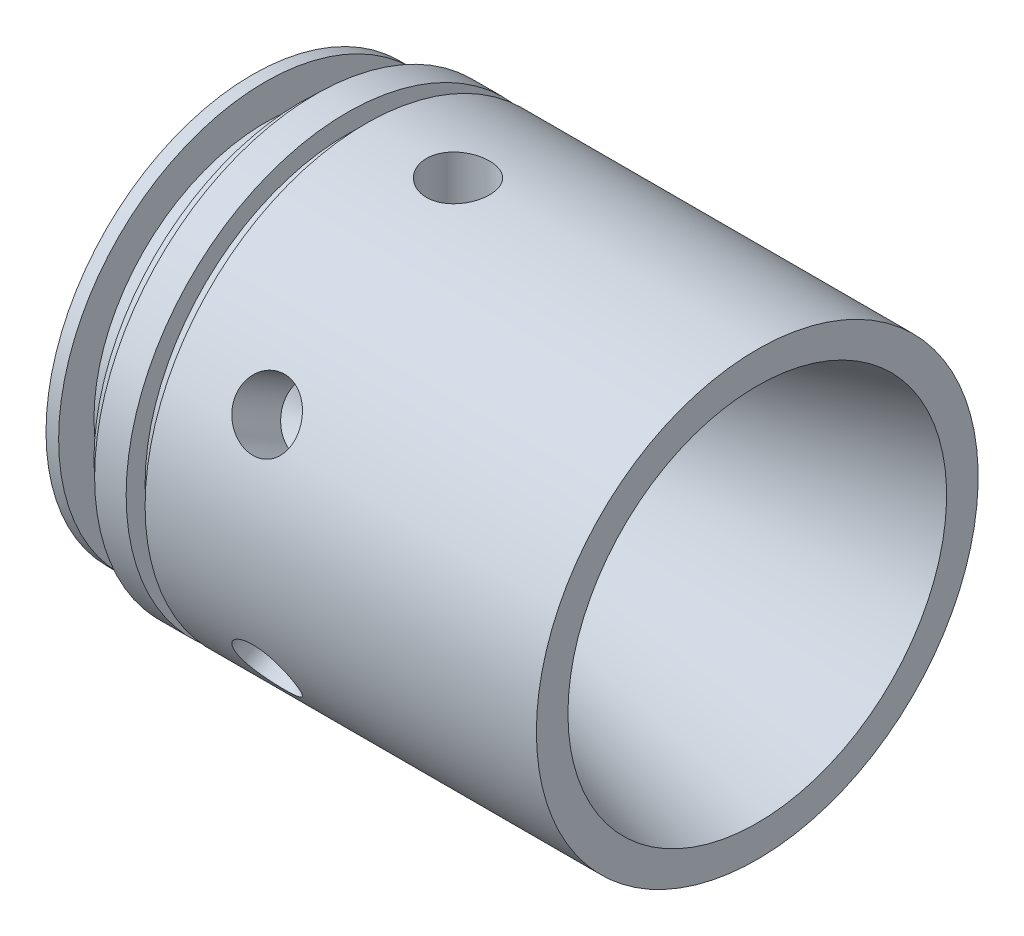
from build123d import *

# Parameters (mm, degrees)
CIRPATTERN1_COUNT = 6


with BuildPart() as part:
    # Sketch2 → Revolve2 (revolve)
    with BuildSketch(Plane.XY, mode=Mode.PRIVATE) as revolve2_sk:
        Polygon((-20.32, 31.75), (-12.192, 26.67), (15.766051224, 26.67), (21.06299661, 21.373054614), (81.28, 38.1), (81.28, 44.45), (2.54, 44.45), (2.54, 40.64), (-1.27, 40.64), (-1.27, 44.45), (-7.62, 44.45), (-7.62, 41.529), (-10.668, 41.529), (-10.668, 34.417), (-17.78, 34.417), (-17.78, 41.529), (-20.32, 41.529), align=None)
    revolve(revolve2_sk.sketch.rotate(Axis((0, 0, 0), (1, 0, 0)), 90), axis=Axis((0, 0, 0), (1, 0, 0)))

    # Sketch4 → 1/2 (0.5) Diameter Hole1 (revolve, cut)
    with BuildSketch(Plane(origin=(21.06299661, 44.45, 0), x_dir=(0, 0, 1), z_dir=(1, 0, 0))):
        Polygon((0, 0), (0, 15.24), (6.35, 11.424535069), (6.35, 0), align=None)
    f_1_2_0_5_diameter_hole1 = revolve(axis=Axis((21.06299661, 50.8, 0), (0, -1, 0)), mode=Mode.SUBTRACT)

    # CirPattern1: 1/2 (0.5) Diameter Hole1 ×6 about axis
    cirpattern1_axis = Axis((0, 0, 0), (1, 0, 0))
    for i in range(1, CIRPATTERN1_COUNT):
        add(f_1_2_0_5_diameter_hole1.rotate(cirpattern1_axis, i * 360 / CIRPATTERN1_COUNT), mode=Mode.SUBTRACT)


solid = part.part
